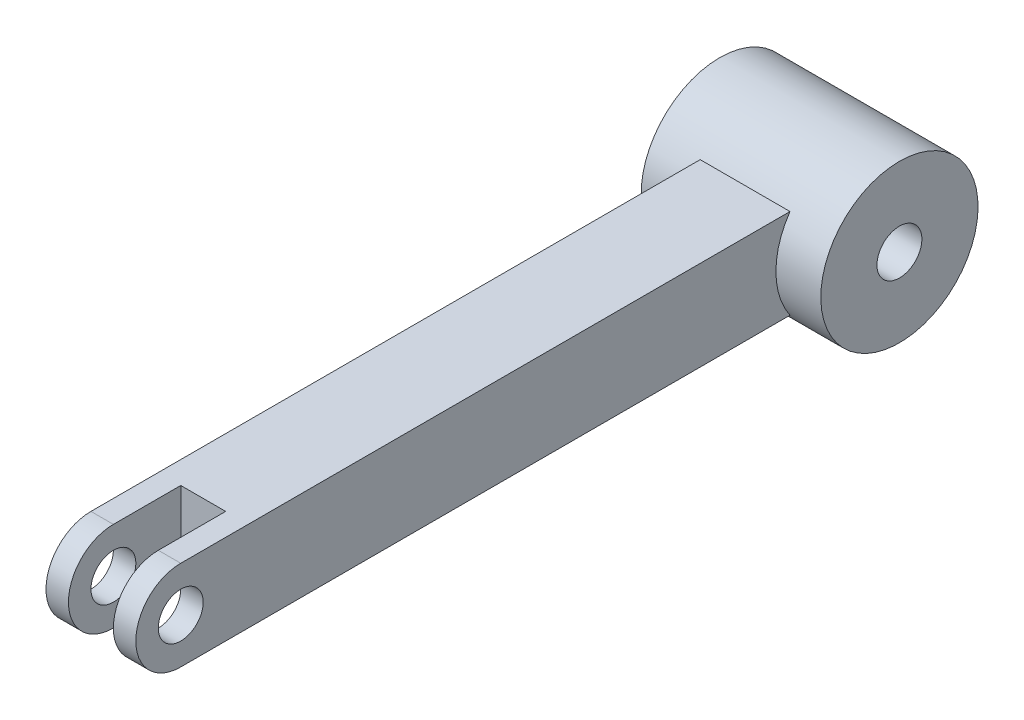
from build123d import *

# Parameters (mm, degrees)
SKETCH1_W                = 4
SKETCH1_H                = 4
BOSS_EXTRUDE1_DEPTH      = 30
SKETCH2_R                = 2
SKETCH2_R_2              = 1
BOSS_EXTRUDE2_DEPTH      = 4
SKETCH3_R                = 1
CUT_EXTRUDE1_DEPTH       = 33.310988843
BOSS_EXTRUDE3_DEPTH      = 2
BOSS_EXTRUDE3_DEPTH_BACK = 6
SKETCH4_R                = 3.5
SKETCH4_R_2              = 1
SKETCH5_R                = 1
CUT_EXTRUDE2_DEPTH       = 34.170016581
CUT_EXTRUDE3_DEPTH       = 10
CUT_EXTRUDE3_DEPTH_BACK  = 2
SKETCH6_W                = 2
SKETCH6_H                = 5


with BuildPart() as part:
    # Sketch1 → Boss-Extrude1 (new body)
    with BuildSketch(Plane.XY):
        Rectangle(SKETCH1_W, SKETCH1_H)
    extrude(amount=BOSS_EXTRUDE1_DEPTH)

    # Sketch2 → Boss-Extrude2 (add)
    with BuildSketch(Plane(origin=(2, 0, 0), x_dir=(0, 0, -1), z_dir=(1, 0, 0))):
        with Locations((-30, 0)):
            Circle(SKETCH2_R)
        with Locations((-30, 0)):
            Circle(SKETCH2_R_2, mode=Mode.SUBTRACT)
    extrude(amount=-BOSS_EXTRUDE2_DEPTH)

    # Sketch3 → Cut-Extrude1 (cut, through all)
    with BuildSketch(Plane(origin=(2, 0, 0), x_dir=(0, 0, -1), z_dir=(1, 0, 0))):
        with Locations(Location((-30, 0, 0), (0, 0, 90))):
            Circle(SKETCH3_R)
    extrude(amount=-CUT_EXTRUDE1_DEPTH, mode=Mode.SUBTRACT)

    # Sketch4 → Boss-Extrude3 (add, two sides: drawn at the far end of the back side and taken through both)
    with BuildSketch(Plane(origin=(2, 0, 0), x_dir=(0, 0, -1), z_dir=(1, 0, 0)).offset(-BOSS_EXTRUDE3_DEPTH_BACK)):
        with Locations(Location((0, 0, 0), (0, 0, 90))):
            Circle(SKETCH4_R)
        with Locations(Location((0, 0, 0), (0, 0, 90))):
            Circle(SKETCH4_R_2, mode=Mode.SUBTRACT)
    extrude(amount=BOSS_EXTRUDE3_DEPTH + BOSS_EXTRUDE3_DEPTH_BACK)

    # Sketch5 → Cut-Extrude2 (cut, through all)
    with BuildSketch(Plane(origin=(4, 0, 0), x_dir=(0, 0, -1), z_dir=(1, 0, 0))):
        with Locations(Location((0, 0, 0), (0, 0, 90))):
            Circle(SKETCH5_R)
    extrude(amount=-CUT_EXTRUDE2_DEPTH, mode=Mode.SUBTRACT)

    # Sketch6 → Cut-Extrude3 (cut, two sides: drawn at the far end of the back side and taken through both)
    with BuildSketch(Plane.XY.offset(29).offset(-CUT_EXTRUDE3_DEPTH_BACK)):
        Rectangle(SKETCH6_W, SKETCH6_H)
    extrude(amount=CUT_EXTRUDE3_DEPTH + CUT_EXTRUDE3_DEPTH_BACK, mode=Mode.SUBTRACT)


solid = part.part
